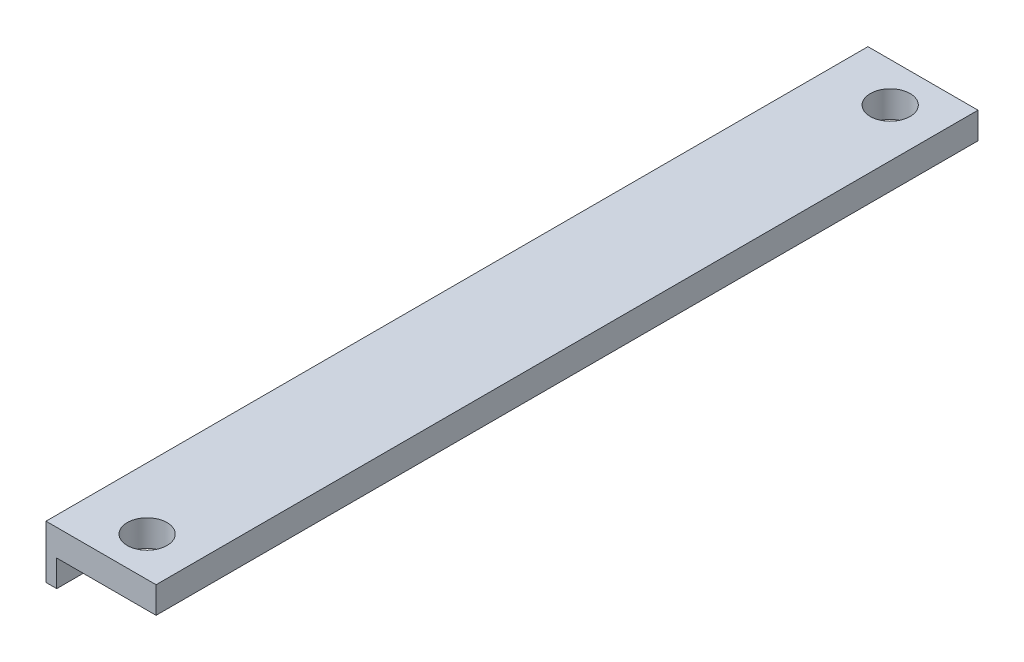
from build123d import *

# Parameters (mm, degrees)
SKETCH1_W               = 108.761980125
SKETCH1_H               = 61.936744186
BOSS_EXTRUDE1_DEPTH     = 2
SKETCH2_R               = 1.5
CUT_EXTRUDE1_DEPTH      = 63.943741049
MIRROR2_COPY_1_SKETCH_R = 1.5
MIRROR2_COPY_1_DEPTH    = 63.943741049
SKETCH3_W               = 94.024869854
SKETCH3_H               = 56.555498618
CUT_EXTRUDE2_DEPTH      = 63.943741049
SKETCH6_W               = 101.2762547
SKETCH6_H               = 61.936744186
CUT_EXTRUDE5_DEPTH      = 10
SKETCH8_W               = 0.808555921
SKETCH8_H               = 61.936744186
BOSS_EXTRUDE2_DEPTH     = 4


with BuildPart() as part:
    # Sketch1 → Boss-Extrude1 (new body)
    with BuildSketch(Plane(origin=(0, 0, 0), x_dir=(1, 0, 0), z_dir=(0, 1, 0))):
        with Locations((-0.380990063, 0)):
            Rectangle(SKETCH1_W, SKETCH1_H)
    extrude(amount=BOSS_EXTRUDE1_DEPTH)

    # Sketch2 → Cut-Extrude1 (cut, through all)
    with BuildSketch(Plane(origin=(0, 2, 0), x_dir=(1, 0, 0), z_dir=(0, 1, 0))):
        with Locations(Location((-50.921572875, 27.996572875, 0), (0, 0, 270))):
            Circle(SKETCH2_R)
    cut_extrude1 = extrude(amount=-CUT_EXTRUDE1_DEPTH, mode=Mode.SUBTRACT)

    # Mirror1: Cut-Extrude1 across plane
    add(cut_extrude1.mirror(Plane.XY), mode=Mode.SUBTRACT)

    # Mirror2: Cut-Extrude1 across plane
    add(cut_extrude1.mirror(Plane.ZY.offset(0.380990062)), mode=Mode.SUBTRACT)

    # Mirror2 copy 1 sketch → Mirror2 copy 1 (cut, through all)
    with BuildSketch(Plane(origin=(-0.761980125, 2, 0), x_dir=(-1, 0, 0), z_dir=(0, 1, 0))):
        with Locations(Location((-50.921572875, 27.996572875, 0), (0, 0, 270))):
            Circle(MIRROR2_COPY_1_SKETCH_R)
    extrude(amount=-MIRROR2_COPY_1_DEPTH, mode=Mode.SUBTRACT)

    # Sketch3 → Cut-Extrude2 (cut, through all)
    with BuildSketch(Plane(origin=(0, 2, 0), x_dir=(1, 0, 0), z_dir=(0, 1, 0))):
        Rectangle(SKETCH3_W, SKETCH3_H)
    extrude(amount=-CUT_EXTRUDE2_DEPTH, mode=Mode.SUBTRACT)

    # Sketch6 → Cut-Extrude5 (cut)
    with BuildSketch(Plane(origin=(0, 2, 0), x_dir=(1, 0, 0), z_dir=(0, 1, 0))):
        with Locations((3.36187265, 0)):
            Rectangle(SKETCH6_W, SKETCH6_H)
    extrude(amount=-CUT_EXTRUDE5_DEPTH, mode=Mode.SUBTRACT)

    # Sketch8 → Boss-Extrude2 (add)
    with BuildSketch(Plane(origin=(0, 2, 0), x_dir=(1, 0, 0), z_dir=(0, 1, 0))):
        with Locations((-55.166258086, 0)):
            Rectangle(SKETCH8_W, SKETCH8_H)
    extrude(amount=-BOSS_EXTRUDE2_DEPTH)


solid = part.part
